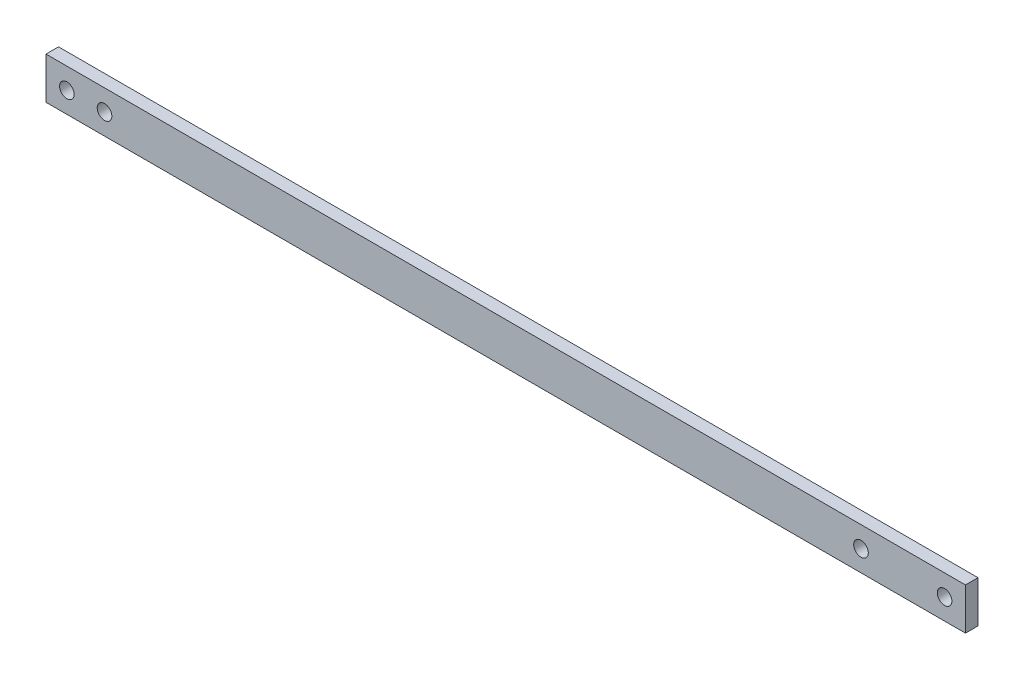
from build123d import *

# Parameters (mm, degrees)
SKETCH_1_W      = 100
SKETCH_1_H      = 10
SKETCH_1_R      = 1.75
SKETCH_1_W_2    = 20
EXTRUDE_1_DEPTH = 3


with BuildPart() as part:
    # 草图1 → 凸台-拉伸1 (new body)
    # profile 1 of 3: a face of its own
    with BuildSketch(Plane.XY):
        with Locations((50, 5)):
            Rectangle(SKETCH_1_W, SKETCH_1_H)
        with Locations((5, 5)):
            Circle(SKETCH_1_R, mode=Mode.SUBTRACT)
        with Locations((14, 5)):
            Circle(SKETCH_1_R, mode=Mode.SUBTRACT)
    # profile 2 of 3: a face of its own
    with BuildSketch(Plane.XY):
        with Locations((150, 5)):
            Rectangle(SKETCH_1_W, SKETCH_1_H)
        with Locations((195, 5)):
            Circle(SKETCH_1_R, mode=Mode.SUBTRACT)
    # profile 3 of 3: a face of its own
    with BuildSketch(Plane.XY):
        with Locations((210, 5)):
            Rectangle(SKETCH_1_W_2, SKETCH_1_H)
        with Locations((215, 5)):
            Circle(SKETCH_1_R, mode=Mode.SUBTRACT)
    extrude(amount=EXTRUDE_1_DEPTH)


solid = part.part
